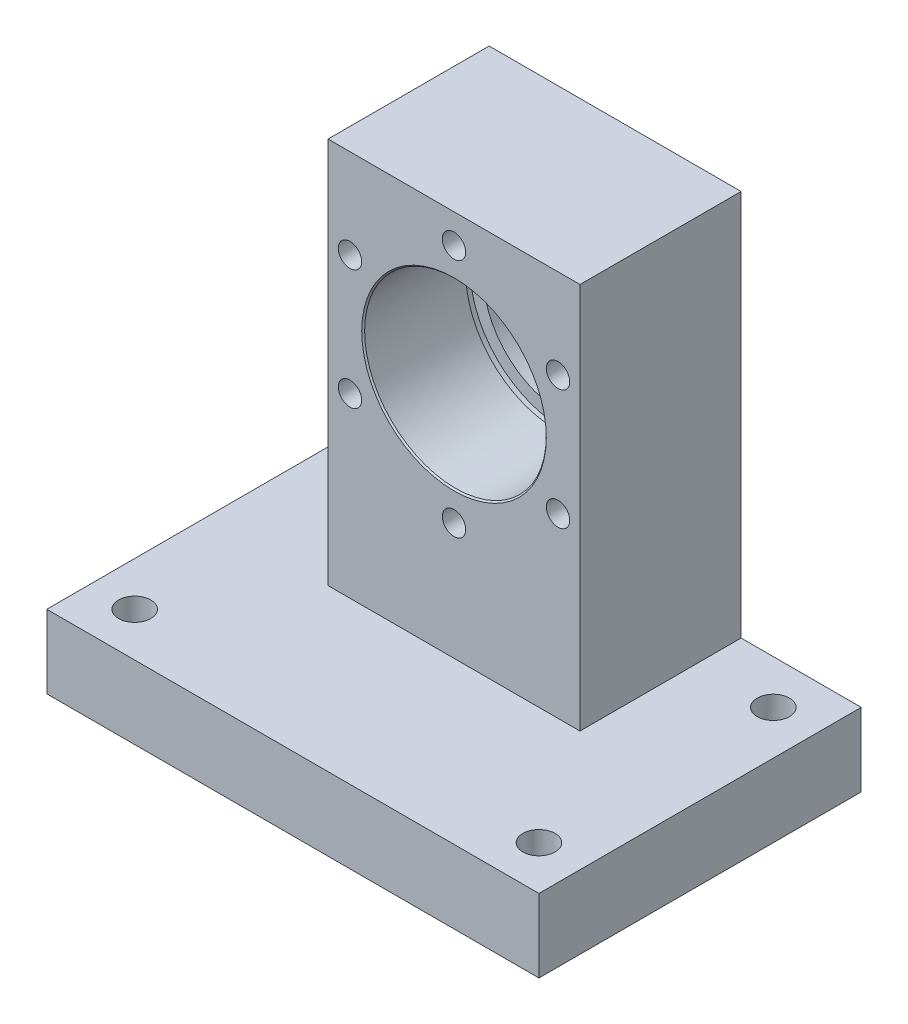
from build123d import *

# Parameters (mm, degrees)
SKETCH_1_W          = 168
SKETCH_1_H          = 110
EXTRUDE_1_DEPTH     = 25
SKETCH_2_R          = 5.5
CUT_EXTRUDE_1_DEPTH = 203.358592602
SKETCH_3_W          = 86
SKETCH_3_H          = 55
EXTRUDE_2_DEPTH     = 132
SKETCH_4_R          = 31
CUT_EXTRUDE_2_DEPTH = 35
CHAMFER_1_SIZE      = 0.5
SKETCH_24_R         = 27
CUT_EXTRUDE_6_DEPTH = 18
SKETCH_25_R         = 31.5
CUT_EXTRUDE_7_DEPTH = 2
SKETCH_26_R         = 4
CUT_EXTRUDE_8_DEPTH = 21


with BuildPart() as part:
    # 草图1 → 凸台-拉伸1 (new body)
    with BuildSketch(Plane(origin=(0, 0, 0), x_dir=(1, 0, 0), z_dir=(0, 1, 0))):
        with Locations((84, 55)):
            Rectangle(SKETCH_1_W, SKETCH_1_H)
    extrude(amount=EXTRUDE_1_DEPTH)

    # 草图2 → 切除-拉伸1 (cut, through all)
    with BuildSketch(Plane(origin=(0, 25, 0), x_dir=(1, 0, 0), z_dir=(0, 1, 0))):
        with Locations(Location((15, 95, 0), (0, 0, 270))):
            Circle(SKETCH_2_R)
        with Locations(Location((153, 95, 0), (0, 0, 90))):
            Circle(SKETCH_2_R)
        with Locations(Location((153, 15, 0), (0, 0, 270))):
            Circle(SKETCH_2_R)
        with Locations(Location((15, 15, 0), (0, 0, 90))):
            Circle(SKETCH_2_R)
    extrude(amount=-CUT_EXTRUDE_1_DEPTH, mode=Mode.SUBTRACT)

    # 草图3 → 凸台-拉伸2 (add)
    with BuildSketch(Plane(origin=(0, 25, 0), x_dir=(1, 0, 0), z_dir=(0, 1, 0))):
        with Locations((84, 82.5)):
            Rectangle(SKETCH_3_W, SKETCH_3_H)
    extrude(amount=EXTRUDE_2_DEPTH)

    # 草图4 → 切除-拉伸2 (cut)
    with BuildSketch(Plane.XY.offset(-55)):
        with Locations((84, 106)):
            Circle(SKETCH_4_R)
    extrude(amount=-CUT_EXTRUDE_2_DEPTH, mode=Mode.SUBTRACT)

    # 倒角1
    chamfer_1_edges = [part.edges().sort_by_distance(p)[0] for p in [
        (53, 106, -55),
    ]]
    chamfer(chamfer_1_edges, length=CHAMFER_1_SIZE)

    # 草图24 → 切除-拉伸6 (cut)
    with BuildSketch(Plane(origin=(0, 0, -110), x_dir=(-1, 0, 0), z_dir=(0, 0, -1))):
        with Locations((-84, 106)):
            Circle(SKETCH_24_R)
    extrude(amount=-CUT_EXTRUDE_6_DEPTH, mode=Mode.SUBTRACT)

    # 草图25 → 切除-拉伸7 (cut)
    with BuildSketch(Plane(origin=(0, 0, -92), x_dir=(-1, 0, 0), z_dir=(0, 0, -1))):
        with Locations((-84, 106)):
            Circle(SKETCH_25_R)
    extrude(amount=-CUT_EXTRUDE_7_DEPTH, mode=Mode.SUBTRACT)

    # 草图26 → 切除-拉伸8 (cut)
    with BuildSketch(Plane.XY.offset(-55)):
        with Locations((84, 147)):
            Circle(SKETCH_26_R)
        with Locations((119.507041555, 126.5)):
            Circle(SKETCH_26_R)
        with Locations((119.507041555, 85.5)):
            Circle(SKETCH_26_R)
        with Locations((84, 65)):
            Circle(SKETCH_26_R)
        with Locations((48.492958445, 85.5)):
            Circle(SKETCH_26_R)
        with Locations((48.492958445, 126.5)):
            Circle(SKETCH_26_R)
    extrude(amount=-CUT_EXTRUDE_8_DEPTH, mode=Mode.SUBTRACT)


solid = part.part
